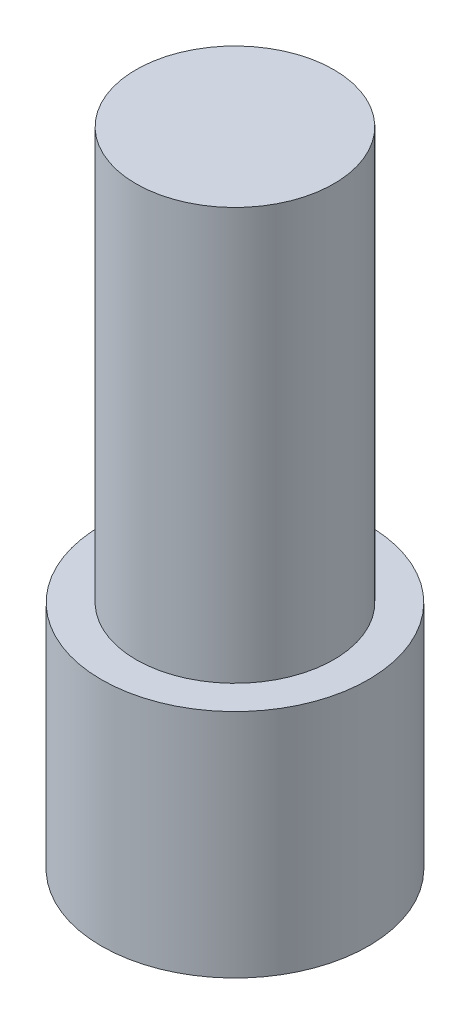
from build123d import *

# Parameters (mm, degrees)
SKETCH1_R           = 4.05
BOSS_EXTRUDE1_DEPTH = 7
SKETCH2_R           = 3
BOSS_EXTRUDE2_DEPTH = 12.5


with BuildPart() as part:
    # Sketch1 → Boss-Extrude1 (new body)
    with BuildSketch(Plane(origin=(0, 0, 0), x_dir=(1, 0, 0), z_dir=(0, 1, 0))):
        with Locations(Location((0, 0, 0), (0, 0, 270))):
            Circle(SKETCH1_R)
    extrude(amount=BOSS_EXTRUDE1_DEPTH)

    # Sketch2 → Boss-Extrude2 (add)
    with BuildSketch(Plane(origin=(0, 7, 0), x_dir=(1, 0, 0), z_dir=(0, 1, 0))):
        with Locations(Location((0, 0, 0), (0, 0, 270))):
            Circle(SKETCH2_R)
    extrude(amount=BOSS_EXTRUDE2_DEPTH)


solid = part.part
